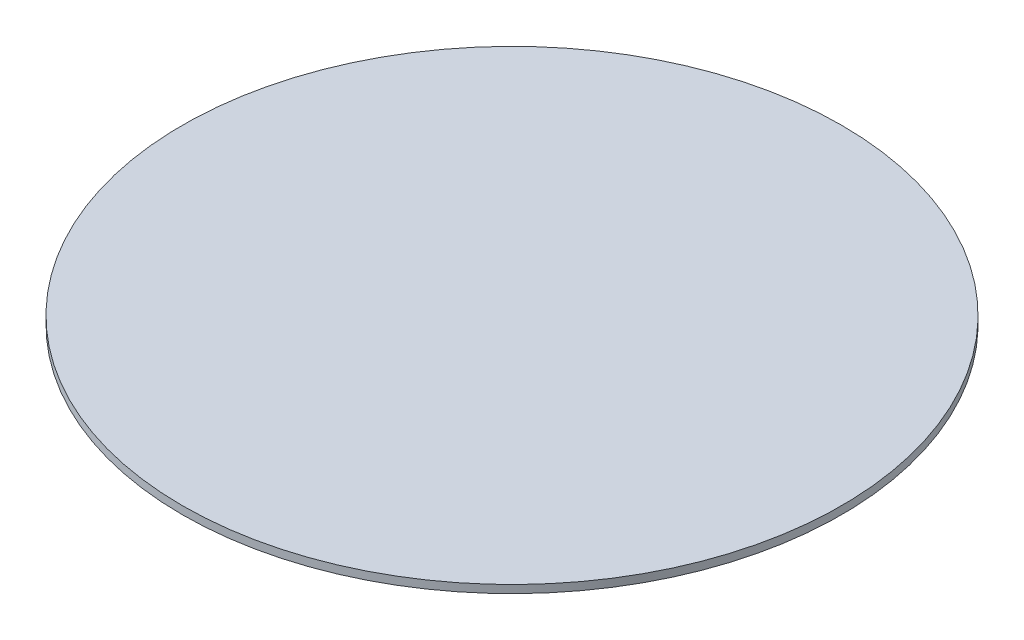
from build123d import *

# Parameters (mm, degrees)
SKETCH_1_R      = 125
EXTRUDE_1_DEPTH = 3


with BuildPart() as part:
    # 草图1 → 凸台-拉伸1 (new body)
    with BuildSketch(Plane(origin=(0, 0, 0), x_dir=(1, 0, 0), z_dir=(0, 1, 0))):
        with Locations(Location((0, 0, 0), (0, 0, 270))):
            Circle(SKETCH_1_R)
    extrude(amount=EXTRUDE_1_DEPTH)


solid = part.part
